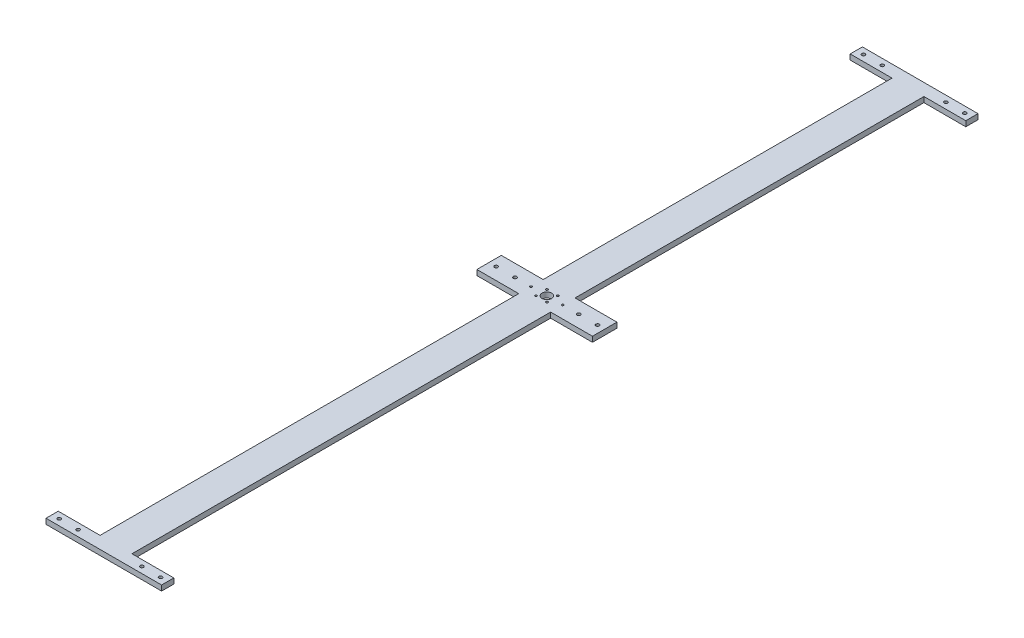
from build123d import *

# Parameters (mm, degrees)
SKETCH1_W                 = 108.8
SKETCH1_H                 = 23
MOUNT_BASE_DEPTH          = 5
SKETCH2_R                 = 1
SKETCH2_R_2               = 4.5
BRACKET_SCREW_HOLES_DEPTH = 5
SKETCH3_R                 = 1.5875
ANTENNA_SCREW_HOLES_DEPTH = 5
SKETCH6_W                 = 30
SKETCH6_H                 = 5
DIRECTOR_EXTENSION_DEPTH  = 328.35
SKETCH7_W                 = 108.8
SKETCH7_H                 = 5
DIRECTOR_MOUNT_DEPTH      = 11.5
SKETCH10_W                = 30
SKETCH10_H                = 5
REFLECTOR_EXTENSION_DEPTH = 394.02
SKETCH11_W                = 108.8
SKETCH11_H                = 5
REFLECTOR_MOUNT_DEPTH     = 11.5
LPATTERN1_COUNT           = 2
LPATTERN1_PITCH           = 411.27
LPATTERN1_COL_COUNT       = 2
LPATTERN1_COL_PITCH       = 345.6


with BuildPart() as part:
    # Sketch1 → Mount Base (new body)
    with BuildSketch(Plane(origin=(0, 0, 0), x_dir=(1, 0, 0), z_dir=(0, 1, 0))):
        with Locations((54.4, 11.5)):
            Rectangle(SKETCH1_W, SKETCH1_H)
    extrude(amount=MOUNT_BASE_DEPTH)

    # Sketch2 → Bracket Screw Holes (cut)
    with BuildSketch(Plane(origin=(0, 5, 0), x_dir=(1, 0, 0), z_dir=(0, 1, 0))):
        with Locations(Location((59.55, 16.6, 0), (0, 0, 270))):
            Circle(SKETCH2_R)
        with Locations(Location((59.55, 6.4, 0), (0, 0, 270))):
            Circle(SKETCH2_R)
        with Locations(Location((49.25, 6.4, 0), (0, 0, 270))):
            Circle(SKETCH2_R)
        with Locations(Location((49.25, 16.6, 0), (0, 0, 270))):
            Circle(SKETCH2_R)
        with Locations(Location((69.31, 11.5, 0), (0, 0, 270))):
            Circle(SKETCH2_R)
        with Locations(Location((39.49, 11.5, 0), (0, 0, 270))):
            Circle(SKETCH2_R)
        with Locations(Location((54.4, 11.5, 0), (0, 0, 270))):
            Circle(SKETCH2_R_2)
    extrude(amount=-BRACKET_SCREW_HOLES_DEPTH, mode=Mode.SUBTRACT)

    # Sketch3 → Antenna Screw Holes (cut)
    with BuildSketch(Plane(origin=(0, 5, 0), x_dir=(1, 0, 0), z_dir=(0, 1, 0))):
        with Locations(Location((6.7, 11.5, 0), (0, 0, 270))):
            Circle(SKETCH3_R)
        with Locations(Location((24.4, 11.5, 0), (0, 0, 270))):
            Circle(SKETCH3_R)
        with Locations(Location((84.4, 11.5, 0), (0, 0, 270))):
            Circle(SKETCH3_R)
        with Locations(Location((102.1, 11.5, 0), (0, 0, 270))):
            Circle(SKETCH3_R)
    antenna_screw_holes = extrude(amount=-ANTENNA_SCREW_HOLES_DEPTH, mode=Mode.SUBTRACT)

    # Sketch6 → Director Extension (add)
    with BuildSketch(Plane(origin=(0, 0, -23), x_dir=(-1, 0, 0), z_dir=(0, 0, -1))):
        with Locations((-54.4, 2.5)):
            Rectangle(SKETCH6_W, SKETCH6_H)
    extrude(amount=DIRECTOR_EXTENSION_DEPTH)

    # Sketch7 → Director Mount (add)
    with BuildSketch(Plane(origin=(0, 0, -351.35), x_dir=(-1, 0, 0), z_dir=(0, 0, -1))):
        with Locations((-54.4, 2.5)):
            Rectangle(SKETCH7_W, SKETCH7_H)
    extrude(amount=DIRECTOR_MOUNT_DEPTH)

    # Sketch10 → Reflector Extension (add)
    with BuildSketch(Plane.XY):
        with Locations((54.4, 2.5)):
            Rectangle(SKETCH10_W, SKETCH10_H)
    extrude(amount=REFLECTOR_EXTENSION_DEPTH)

    # Sketch11 → Reflector Mount (add)
    with BuildSketch(Plane.XY.offset(394.02)):
        with Locations((54.4, 2.5)):
            Rectangle(SKETCH11_W, SKETCH11_H)
    extrude(amount=REFLECTOR_MOUNT_DEPTH)

    # LPattern1: Antenna Screw Holes ×2
    with Locations(*[(0, 0, i * LPATTERN1_PITCH) for i in range(1, LPATTERN1_COUNT)]):
        add(antenna_screw_holes, mode=Mode.SUBTRACT)

    # LPattern1 col: Antenna Screw Holes ×2
    with Locations(*[(0, 0, -i * LPATTERN1_COL_PITCH) for i in range(1, LPATTERN1_COL_COUNT)]):
        add(antenna_screw_holes, mode=Mode.SUBTRACT)


solid = part.part
